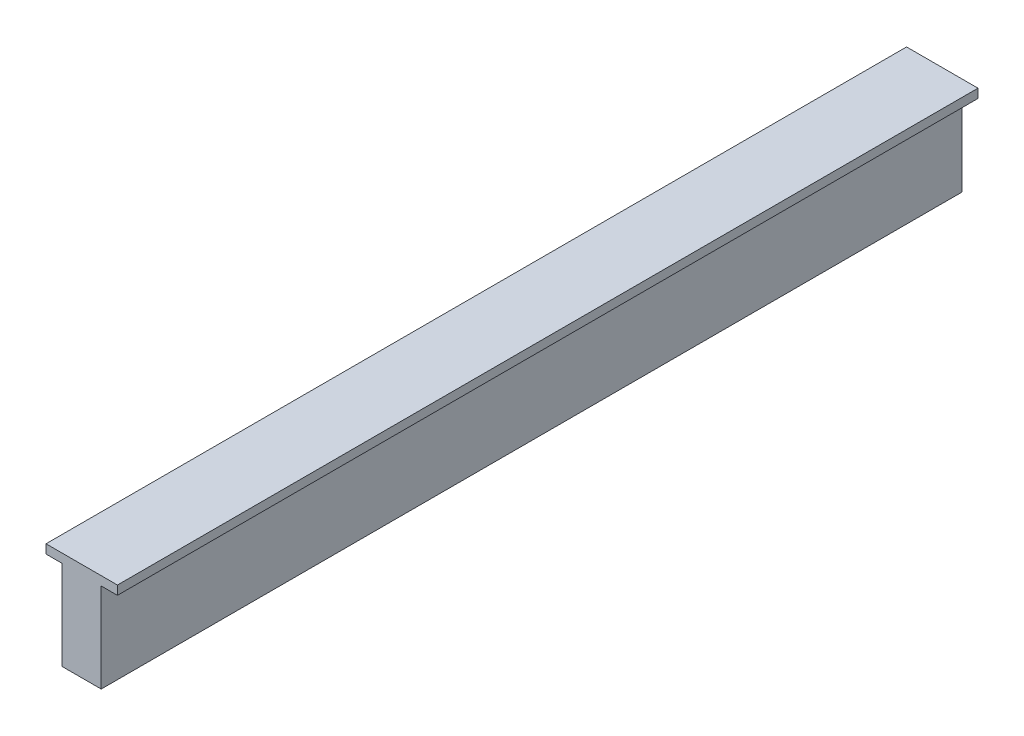
from build123d import *

# Parameters (mm, degrees)
BOSS_EXTRUDE1_DEPTH = 265


with BuildPart() as part:
    # Sketch1 → Boss-Extrude1 (new, symmetric)
    with BuildSketch(Plane.XY):
        Polygon((-22, 0), (22, 0), (22, -5.5), (12, -5.5), (12, -60.5), (-12, -60.5), (-12, -5.5), (-22, -5.5), align=None)
    extrude(amount=BOSS_EXTRUDE1_DEPTH, both=True)


solid = part.part
